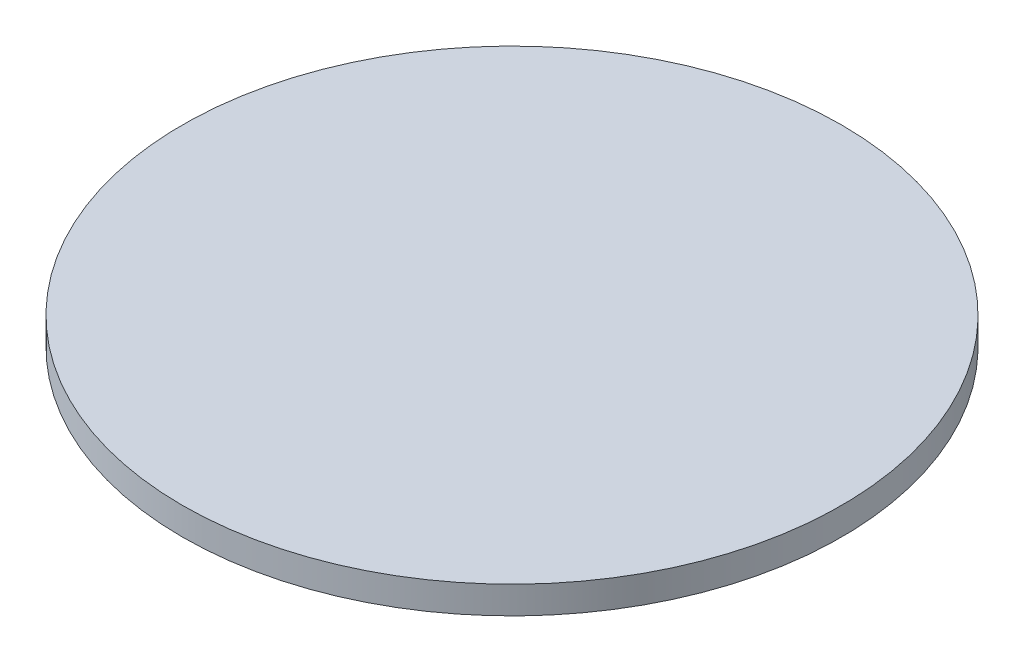
from build123d import *

# Parameters (mm, degrees)
BOSS_EXTRUDE1_DEPTH      = 1.5875
BOSS_EXTRUDE1_DEPTH_BACK = 1.5875
SKETCH3_R                = 38.1


with BuildPart() as part:
    # Sketch3 → Boss-Extrude1 (new, two sides: drawn at the far end of the back side and taken through both)
    with BuildSketch(Plane(origin=(0, 0, 0), x_dir=(1, 0, 0), z_dir=(0, 1, 0)).offset(-BOSS_EXTRUDE1_DEPTH_BACK)):
        with Locations(Location((0, 0, 0), (0, 0, 270))):
            Circle(SKETCH3_R)
    extrude(amount=BOSS_EXTRUDE1_DEPTH + BOSS_EXTRUDE1_DEPTH_BACK)


solid = part.part
